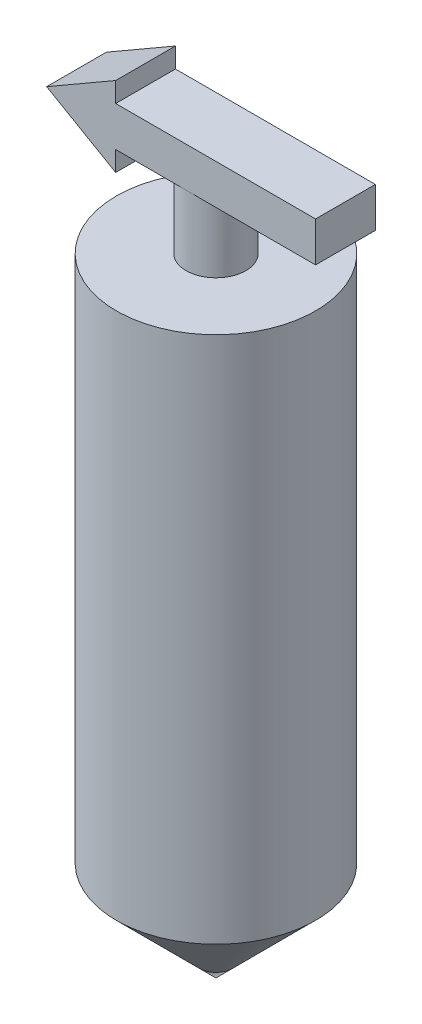
from build123d import *

# Parameters (mm, degrees)
EXTRUDE_1_DEPTH = 3


with BuildPart() as part:
    # 草图1 → 旋转1 (revolve)
    with BuildSketch(Plane.XY, mode=Mode.PRIVATE) as revolve_1_sk:
        Polygon((0, 70), (0, 0), (10, 10), (10, 63), (3, 63), (3, 70), align=None)
    revolve(revolve_1_sk.sketch.rotate(Axis((0, 70, 0), (0, -1, 0)), 180), axis=Axis((0, 70, 0), (0, -1, 0)))

    # 草图2 → 凸台-拉伸1 (add, symmetric)
    with BuildSketch(Plane.XY):
        Polygon((-14, 72), (-7.07179677, 68), (-7.07179677, 70), (13, 70), (13, 74), (-7.07179677, 74), (-7.07179677, 76), align=None)
    extrude(amount=EXTRUDE_1_DEPTH, both=True)


solid = part.part
